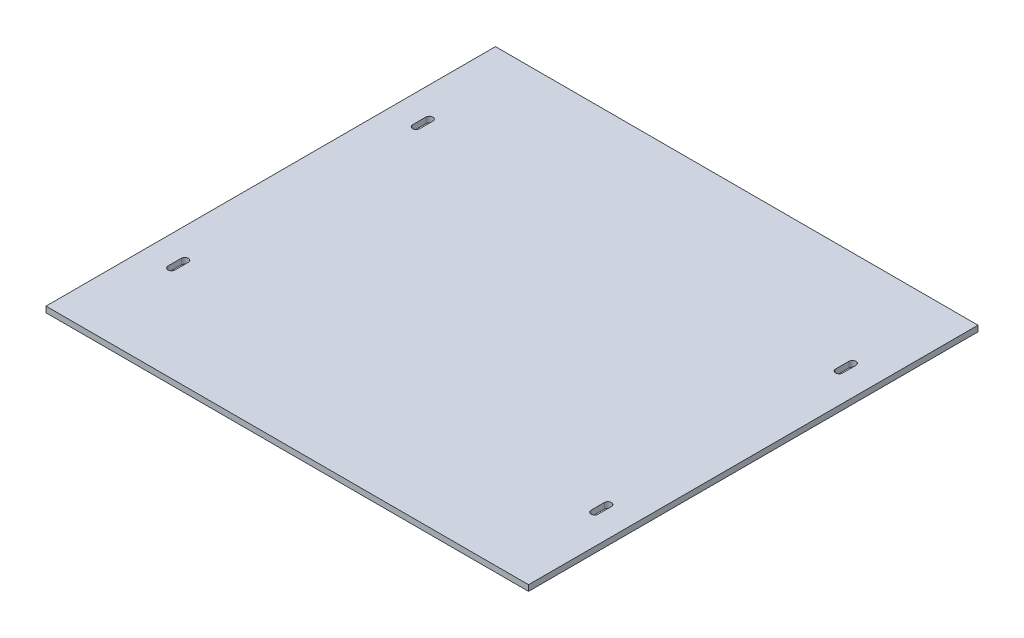
from build123d import *

# Parameters (mm, degrees)
SKETCH1_W           = 463.55
SKETCH1_H           = 431.8
BOSS_EXTRUDE1_DEPTH = 5.588


with BuildPart() as part:
    # Sketch1 → Boss-Extrude1 (new body)
    with BuildSketch(Plane(origin=(0, 0, 0), x_dir=(1, 0, 0), z_dir=(0, 1, 0))):
        with Locations((231.775, 215.9)):
            Rectangle(SKETCH1_W, SKETCH1_H)
        with BuildLine():
            Line((31.9532, 339.725), (31.9532, 327.025))
            ThreePointArc((31.9532, 327.025), (28.575, 323.6468), (25.1968, 327.025))
            Line((25.1968, 327.025), (25.1968, 339.725))
            ThreePointArc((25.1968, 339.725), (28.575, 343.1032), (31.9532, 339.725))
        make_face(mode=Mode.SUBTRACT)
        with BuildLine():
            Line((31.9532, 92.075), (31.9532, 104.775))
            ThreePointArc((31.9532, 104.775), (28.575, 108.1532), (25.1968, 104.775))
            Line((25.1968, 104.775), (25.1968, 92.075))
            ThreePointArc((25.1968, 92.075), (28.575, 88.6968), (31.9532, 92.075))
        make_face(mode=Mode.SUBTRACT)
        with BuildLine():
            Line((431.5968, 92.075), (431.5968, 104.775))
            ThreePointArc((431.5968, 104.775), (434.975, 108.1532), (438.3532, 104.775))
            Line((438.3532, 104.775), (438.3532, 92.075))
            ThreePointArc((438.3532, 92.075), (434.975, 88.6968), (431.5968, 92.075))
        make_face(mode=Mode.SUBTRACT)
        with BuildLine():
            Line((431.5968, 339.725), (431.5968, 327.025))
            ThreePointArc((431.5968, 327.025), (434.975, 323.6468), (438.3532, 327.025))
            Line((438.3532, 327.025), (438.3532, 339.725))
            ThreePointArc((438.3532, 339.725), (434.975, 343.1032), (431.5968, 339.725))
        make_face(mode=Mode.SUBTRACT)
    extrude(amount=BOSS_EXTRUDE1_DEPTH)


solid = part.part
